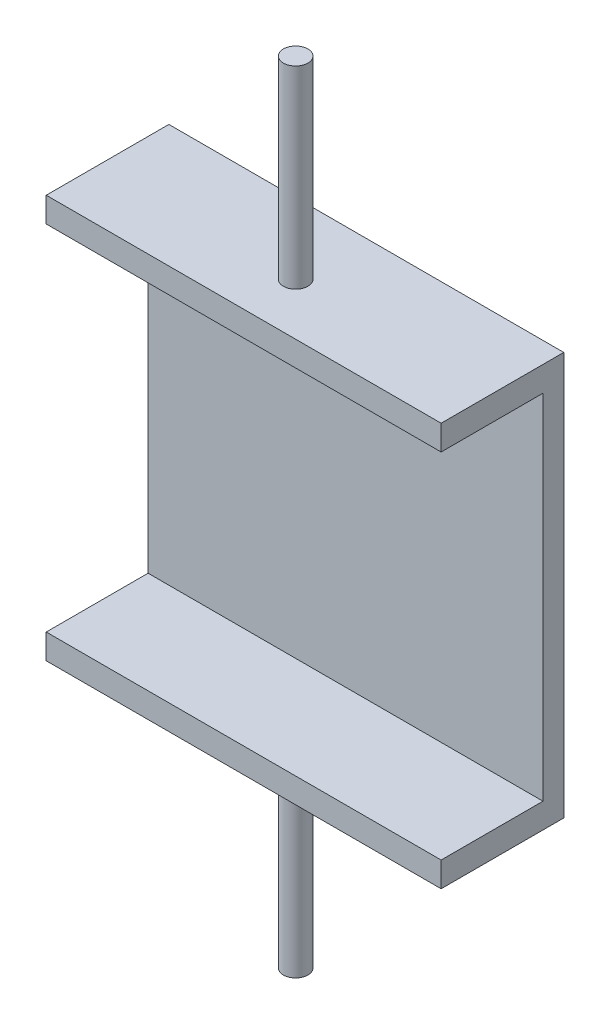
from build123d import *

# Parameters (mm, degrees)
SKETCH1_W           = 190
SKETCH1_H           = 170
BOSS_EXTRUDE1_DEPTH = 10
SKETCH2_W           = 190
SKETCH2_H           = 59
BOSS_EXTRUDE2_DEPTH = 12
SKETCH3_W           = 190
SKETCH3_H           = 59
BOSS_EXTRUDE3_DEPTH = 12
SKETCH4_R           = 5.9
BOSS_EXTRUDE4_DEPTH = 105
SKETCH5_R           = 5.9
BOSS_EXTRUDE5_DEPTH = 105


with BuildPart() as part:
    # Sketch1 → Boss-Extrude1 (new body)
    with BuildSketch(Plane.XY.offset(123)):
        with Locations((300, 300)):
            Rectangle(SKETCH1_W, SKETCH1_H)
    extrude(amount=BOSS_EXTRUDE1_DEPTH)

    # Sketch2 → Boss-Extrude2 (add)
    with BuildSketch(Plane(origin=(0, 385, 0), x_dir=(1, 0, 0), z_dir=(0, 1, 0))):
        with Locations((300, -152.5)):
            Rectangle(SKETCH2_W, SKETCH2_H)
    extrude(amount=BOSS_EXTRUDE2_DEPTH)

    # Sketch3 → Boss-Extrude3 (add)
    with BuildSketch(Plane(origin=(0, 203, 0), x_dir=(1, 0, 0), z_dir=(0, 1, 0))):
        with Locations((300, -152.5)):
            Rectangle(SKETCH3_W, SKETCH3_H)
    extrude(amount=BOSS_EXTRUDE3_DEPTH)

    # Sketch4 → Boss-Extrude4 (add)
    with BuildSketch(Plane(origin=(0, 385, 0), x_dir=(1, 0, 0), z_dir=(0, 1, 0))):
        with Locations(Location((300, -157, 0), (0, 0, 270))):
            Circle(SKETCH4_R)
    extrude(amount=BOSS_EXTRUDE4_DEPTH)

    # Sketch5 → Boss-Extrude5 (add)
    with BuildSketch(Plane(origin=(0, 110, 0), x_dir=(1, 0, 0), z_dir=(0, 1, 0))):
        with Locations(Location((300, -157, 0), (0, 0, 270))):
            Circle(SKETCH5_R)
    extrude(amount=BOSS_EXTRUDE5_DEPTH)


solid = part.part
